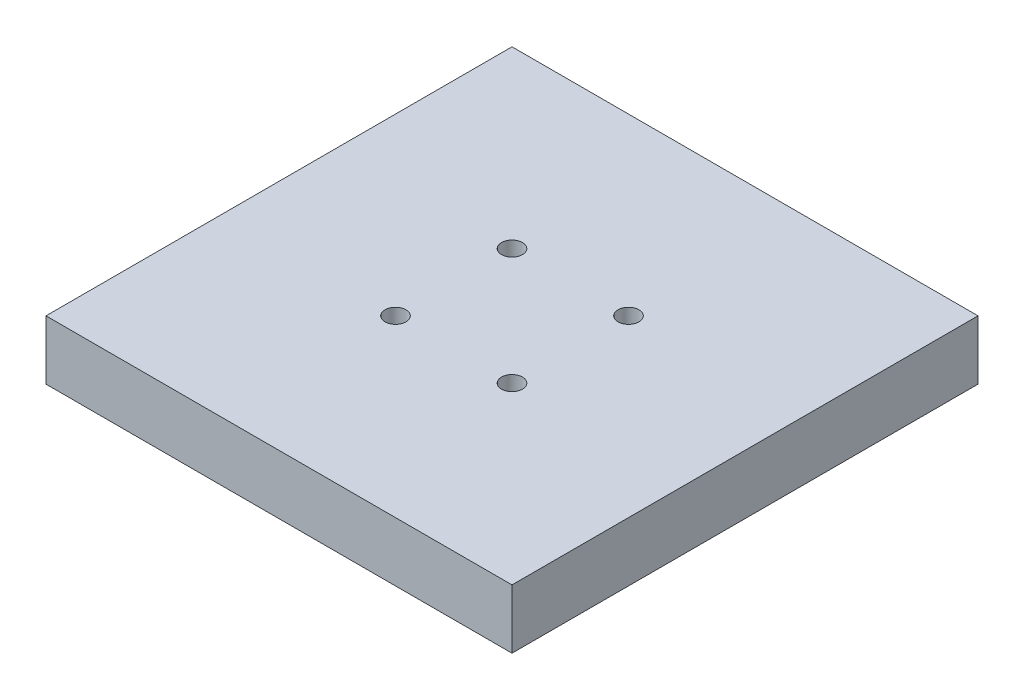
from build123d import *

# Parameters (mm, degrees)
CROQUIS1_W              = 100
CROQUIS1_H              = 100
SALIENTE_EXTRUIR1_DEPTH = 12.7
CROQUIS3_OUTSIDE_W      = 130.398
CROQUIS3_OUTSIDE_H      = 130.398
CROQUIS3_OUTSIDE_W_2    = 100
CROQUIS3_OUTSIDE_H_2    = 100
CROQUIS3_OUTSIDE_R      = 2.25
CORTAR_EXTRUIR1_DEPTH   = 72.842118566


with BuildPart() as part:
    # Croquis1 → Saliente-Extruir1 (new body)
    with BuildSketch(Plane(origin=(0, 0, 0), x_dir=(1, 0, 0), z_dir=(0, 1, 0))):
        Rectangle(CROQUIS1_W, CROQUIS1_H)
    extrude(amount=SALIENTE_EXTRUIR1_DEPTH)

    # Croquis3 outside → Cortar-Extruir1 (cut, through all)
    # profile 1 of 5: a face of its own
    with BuildSketch(Plane.XZ):
        Rectangle(CROQUIS3_OUTSIDE_W, CROQUIS3_OUTSIDE_H)
        Rectangle(CROQUIS3_OUTSIDE_W_2, CROQUIS3_OUTSIDE_H_2, mode=Mode.SUBTRACT)
    # profile 2 of 5: a face of its own
    with BuildSketch(Plane.XZ):
        with Locations(Location((-12.5, -12.5, 0), (0, 0, 270))):
            Circle(CROQUIS3_OUTSIDE_R)
    # profile 3 of 5: a face of its own
    with BuildSketch(Plane.XZ):
        with Locations(Location((12.5, -12.5, 0), (0, 0, 270))):
            Circle(CROQUIS3_OUTSIDE_R)
    # profile 4 of 5: a face of its own
    with BuildSketch(Plane.XZ):
        with Locations(Location((-12.5, 12.5, 0), (0, 0, 270))):
            Circle(CROQUIS3_OUTSIDE_R)
    # profile 5 of 5: a face of its own
    with BuildSketch(Plane.XZ):
        with Locations(Location((12.5, 12.5, 0), (0, 0, 270))):
            Circle(CROQUIS3_OUTSIDE_R)
    extrude(amount=-CORTAR_EXTRUIR1_DEPTH, mode=Mode.SUBTRACT)


solid = part.part
